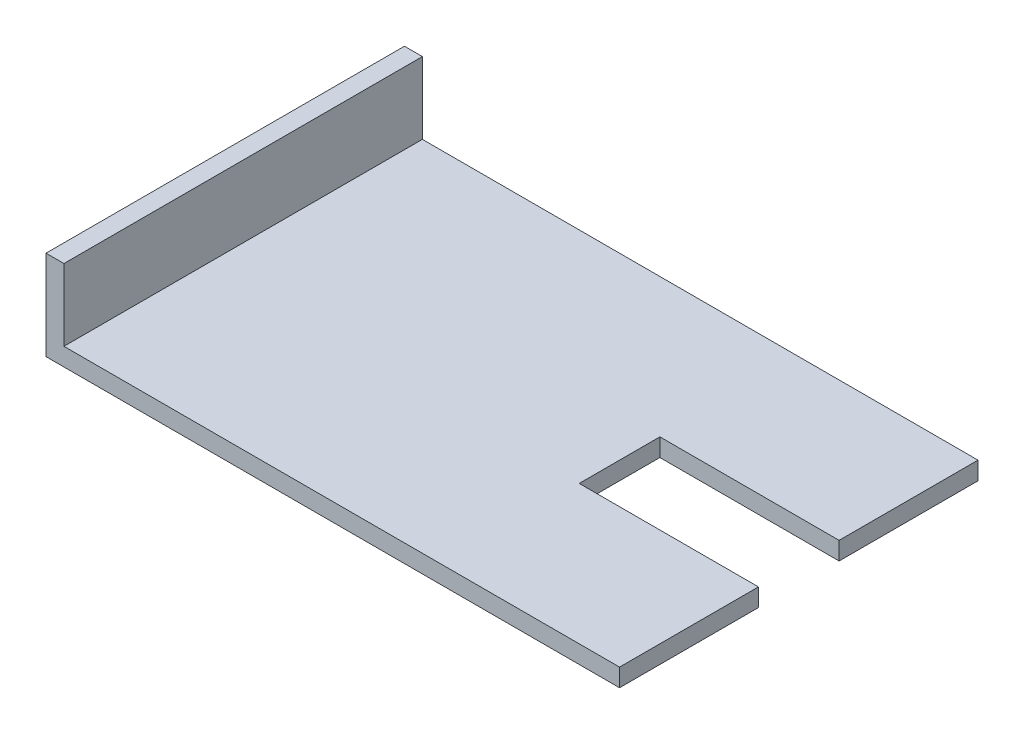
from build123d import *

# Parameters (mm, degrees)
ESQUISSE1_W             = 310
ESQUISSE1_H             = 10
ESQUISSE1_W_2           = 10
ESQUISSE1_H_2           = 40
BOSS_EXTRU_1_DEPTH      = 200
ESQUISSE4_W             = 100
ESQUISSE4_H             = 45
ENL_V_MAT_EXTRU_1_DEPTH = 10


with BuildPart() as part:
    # Esquisse1 → Boss.-Extru.1 (new body)
    with BuildSketch(Plane.XY):
        with Locations((165, 5)):
            Rectangle(ESQUISSE1_W, ESQUISSE1_H)
        with Locations((5, 30)):
            Rectangle(ESQUISSE1_W_2, ESQUISSE1_H_2)
        with Locations((5, 5)):
            Rectangle(ESQUISSE1_W_2, ESQUISSE1_H)
    extrude(amount=BOSS_EXTRU_1_DEPTH)

    # Esquisse4 → Enlèv. mat.-Extru.1 (cut)
    with BuildSketch(Plane(origin=(0, 10, 0), x_dir=(1, 0, 0), z_dir=(0, 1, 0))):
        with Locations((270, -100)):
            Rectangle(ESQUISSE4_W, ESQUISSE4_H)
    extrude(amount=-ENL_V_MAT_EXTRU_1_DEPTH, mode=Mode.SUBTRACT)


solid = part.part
